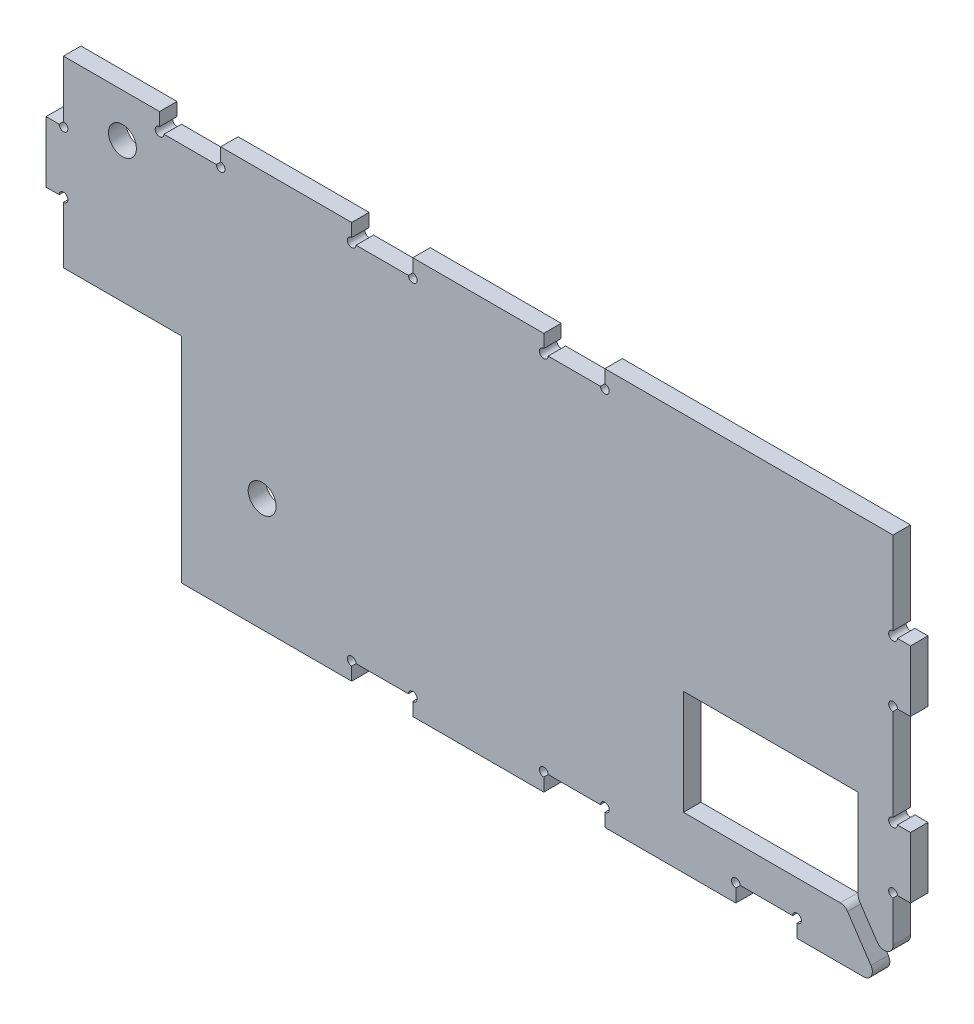
from build123d import *

# Parameters (mm, degrees)
SKETCH_1_W          = 95
SKETCH_1_H          = 45.5
EXTRUDE_1_DEPTH     = 2
SKETCH_2_W          = 7
SKETCH_2_H          = 2
CUT_EXTRUDE_1_DEPTH = 106.352978126
SKETCH_3_R          = 0.5
CUT_EXTRUDE_2_DEPTH = 106.352978126
SKETCH_5_W          = 13.5
SKETCH_5_H          = 24.5
CUT_EXTRUDE_3_DEPTH = 106.352978126
SKETCH_6_W          = 2
SKETCH_6_H          = 7
EXTRUDE_2_DEPTH     = 2
SKETCH_7_W          = 20
SKETCH_7_H          = 12
CUT_EXTRUDE_4_DEPTH = 108.159927212
CUT_EXTRUDE_5_DEPTH = 108.159927212
FILLET_1_R          = 1
SKETCH_9_R          = 1.6
CUT_EXTRUDE_6_DEPTH = 2


with BuildPart() as part:
    # 草图1 → 凸台-拉伸1 (new body)
    with BuildSketch(Plane.XY):
        with Locations((47.5, 22.75)):
            Rectangle(SKETCH_1_W, SKETCH_1_H)
    extrude(amount=EXTRUDE_1_DEPTH)

    # 草图2 → 切除-拉伸1 (cut, through all)
    with BuildSketch(Plane.XY.offset(2)):
        with Locations((58.5, 44.5)):
            Rectangle(SKETCH_2_W, SKETCH_2_H)
        with Locations((36.5, 44.5)):
            Rectangle(SKETCH_2_W, SKETCH_2_H)
        with Locations((14.5, 44.5)):
            Rectangle(SKETCH_2_W, SKETCH_2_H)
        with Locations((36.5, 1)):
            Rectangle(SKETCH_2_W, SKETCH_2_H)
        with Locations((58.5, 1)):
            Rectangle(SKETCH_2_W, SKETCH_2_H)
        with Locations((80.5, 1)):
            Rectangle(SKETCH_2_W, SKETCH_2_H)
    extrude(amount=-CUT_EXTRUDE_1_DEPTH, mode=Mode.SUBTRACT)

    # 草图3 → 切除-拉伸2 (cut, through all)
    with BuildSketch(Plane.XY.offset(2)):
        with Locations((11, 43.5)):
            Circle(SKETCH_3_R)
    cut_extrude_2 = extrude(amount=-CUT_EXTRUDE_2_DEPTH, mode=Mode.SUBTRACT)

    # 草图5 → 切除-拉伸3 (cut, through all)
    with BuildSketch(Plane.XY.offset(2)):
        with Locations((6.75, 12.25)):
            Rectangle(SKETCH_5_W, SKETCH_5_H)
    extrude(amount=-CUT_EXTRUDE_3_DEPTH, mode=Mode.SUBTRACT)

    # 草图6 → 凸台-拉伸2 (add)
    with BuildSketch(Plane.XY.offset(2)):
        with Locations((-1, 35)):
            Rectangle(SKETCH_6_W, SKETCH_6_H)
        with Locations((96, 32)):
            Rectangle(SKETCH_6_W, SKETCH_6_H)
        with Locations((96, 13.5)):
            Rectangle(SKETCH_6_W, SKETCH_6_H)
    extrude(amount=-EXTRUDE_2_DEPTH)

    # 草图阵列1: 切除-拉伸2 at 17 more places
    with Locations((7, 0, 0), (22, 0, 0), (29, 0, 0), (44, 0, 0), (51, 0, 0), (73, -41.5, 0), (66, -41.5, 0), (51, -41.5, 0), (44, -41.5, 0), (29, -41.5, 0), (22, -41.5, 0), (-11, -12, 0), (84, -8, 0), (-11, -5, 0), (84, -15, 0), (84, -26.5, 0), (84, -33.5, 0)):
        add(cut_extrude_2, mode=Mode.SUBTRACT)

    # 草图7 → 切除-拉伸4 (cut, through all)
    with BuildSketch(Plane(origin=(0, 0, 0), x_dir=(-1, 0, 0), z_dir=(0, 0, -1))):
        with Locations((-81, 12)):
            Rectangle(SKETCH_7_W, SKETCH_7_H)
    extrude(amount=-CUT_EXTRUDE_4_DEPTH, mode=Mode.SUBTRACT)

    # 草图8 → 切除-拉伸5 (cut, through all)
    with BuildSketch(Plane(origin=(0, 0, 0), x_dir=(-1, 0, 0), z_dir=(0, 0, -1))):
        Polygon((-91, 7.5), (-95, 1.5), (-95, 0), (-93.5, 0), (-89.5, 6), (-91, 6), align=None)
    extrude(amount=-CUT_EXTRUDE_5_DEPTH, mode=Mode.SUBTRACT)

    # 圆角1
    fillet_1_edges = [part.edges().sort_by_distance(p)[0] for p in [
        (91, 7.5, 1),
        (89.5, 6, 1),
        (93.5, 0, 1),
        (95, 1.5, 1),
    ]]
    fillet(fillet_1_edges, radius=FILLET_1_R)

    # 草图9 → 切除-拉伸6 (cut)
    with BuildSketch(Plane(origin=(0, 0, 0), x_dir=(-1, 0, 0), z_dir=(0, 0, -1))):
        with Locations((-6.75, 40.5)):
            Circle(SKETCH_9_R)
        with Locations((-22.75, 13)):
            Circle(SKETCH_9_R)
    extrude(amount=-CUT_EXTRUDE_6_DEPTH, mode=Mode.SUBTRACT)


solid = part.part
